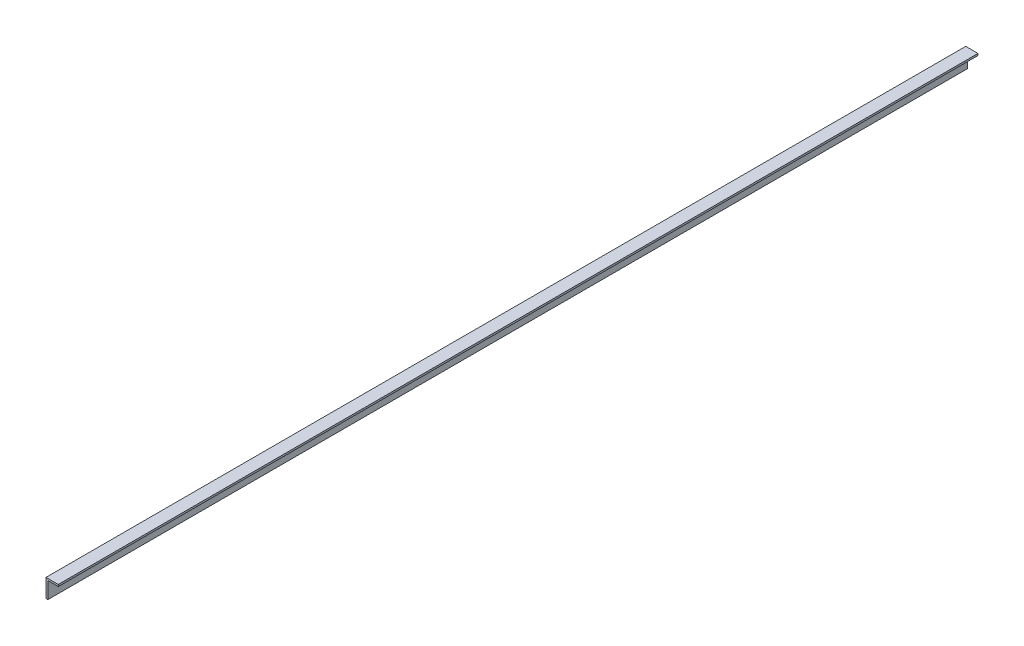
from build123d import *

# Parameters (mm, degrees)
BOSS_EXTRU_1_DEPTH = 1500


with BuildPart() as part:
    # Esquisse1 → Boss.-Extru.1 (new body)
    with BuildSketch(Plane.XY):
        Polygon((0, 0), (0, 30), (20, 30), (20, 27), (3, 27), (3, 0), align=None)
    extrude(amount=BOSS_EXTRU_1_DEPTH)


solid = part.part
